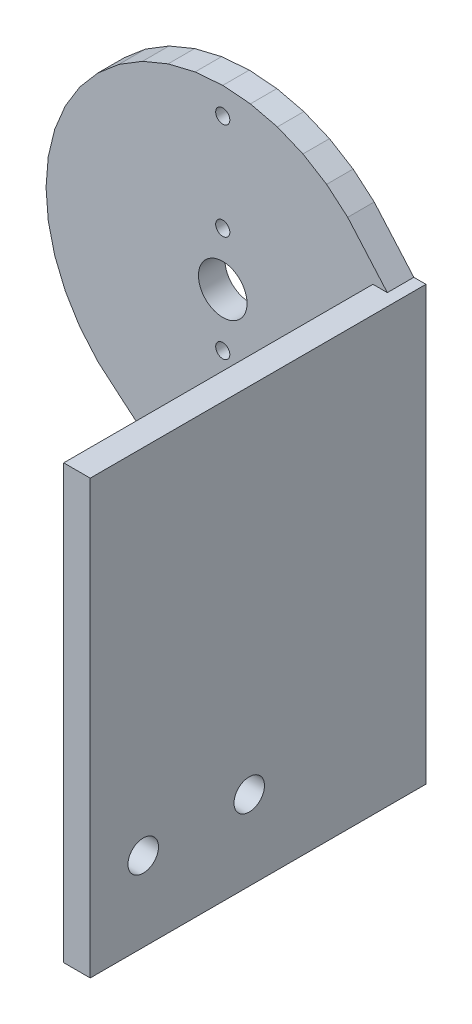
from build123d import *

# Parameters (mm, degrees)
BOSS_EXTRUDE1_START     = -26
BOSS_EXTRUDE1_DEPTH     = 3
BOSS_EXTRUDE2_START     = -26
SKETCH2_W               = 3
SKETCH2_H               = 49
BOSS_EXTRUDE2_DEPTH     = 38
CUT_EXTRUDE1_DEPTH      = 52.730068626
CUT_EXTRUDE1_DEPTH_BACK = 52.730068626
SKETCH3_R               = 2.75
SKETCH3_R_2             = 0.8
CUT_EXTRUDE2_DEPTH      = 52.730068626
CUT_EXTRUDE2_DEPTH_BACK = 52.730068626
SKETCH4_R               = 1.725


with BuildPart() as part:
    # Sketch1 → Boss-Extrude1 (new body)
    with BuildSketch(Plane.XY.offset(BOSS_EXTRUDE1_START)):
        Polygon((-20, 0), (-19.7538, -3.1287), (-19.0211, -6.1803), (-17.8201, -9.0798), (-16.1803, -11.7557), (-14.1421, -14.1421), (-11.7557, -16.1803), (16.0305, -39.5225), (16.365, -39.7275), (16.7275, -39.8776), (17.1089, -39.9692), (17.5, -40), (17.8911, -39.9692), (18.2725, -39.8776), (18.635, -39.7275), (18.9695, -39.5225), (19.2678, -39.2678), (19.5225, -38.9695), (19.7275, -38.635), (19.8776, -38.2725), (19.9692, -37.8911), (20, -37.5), (20, 6.5), (19.9692, 6.8911), (19.8776, 7.2725), (19.7275, 7.635), (19.5225, 7.9695), (19.2678, 8.2678), (14.1421, 14.1421), (11.7557, 16.1803), (9.0798, 17.8201), (6.1803, 19.0211), (3.1287, 19.7538), (0, 20), (-3.1287, 19.7538), (-6.1803, 19.0211), (-9.0798, 17.8201), (-11.7557, 16.1803), (-14.1421, 14.1421), (-16.1803, 11.7557), (-17.8201, 9.0798), (-19.0211, 6.1803), (-19.7538, 3.1287), align=None)
    extrude(amount=BOSS_EXTRUDE1_DEPTH)

    # Sketch2 → Boss-Extrude2 (add)
    with BuildSketch(Plane.XY.offset(BOSS_EXTRUDE2_START)):
        with Locations((18.5, -15.5)):
            Rectangle(SKETCH2_W, SKETCH2_H)
    extrude(amount=BOSS_EXTRUDE2_DEPTH)

    # Sketch3 → Cut-Extrude1 (cut, two sides: drawn at the far end of the back side and taken through both)
    with BuildSketch(Plane.XY.offset(-CUT_EXTRUDE1_DEPTH_BACK)):
        Circle(SKETCH3_R)
        with Locations((0, 6)):
            Circle(SKETCH3_R_2)
        with Locations((0, -6)):
            Circle(SKETCH3_R_2)
        with Locations((0, 17)):
            Circle(SKETCH3_R_2)
        with Locations((0, -17)):
            Circle(SKETCH3_R_2)
    extrude(amount=CUT_EXTRUDE1_DEPTH + CUT_EXTRUDE1_DEPTH_BACK, mode=Mode.SUBTRACT)

    # Sketch4 → Cut-Extrude2 (cut, two sides: drawn at the far end of the back side and taken through both)
    with BuildSketch(Plane(origin=(0, 0, 0), x_dir=(0, 0, -1), z_dir=(1, 0, 0)).offset(-CUT_EXTRUDE2_DEPTH_BACK)):
        with Locations((-6, -31)):
            Circle(SKETCH4_R)
        with Locations((6, -31)):
            Circle(SKETCH4_R)
    extrude(amount=CUT_EXTRUDE2_DEPTH + CUT_EXTRUDE2_DEPTH_BACK, mode=Mode.SUBTRACT)


solid = part.part
